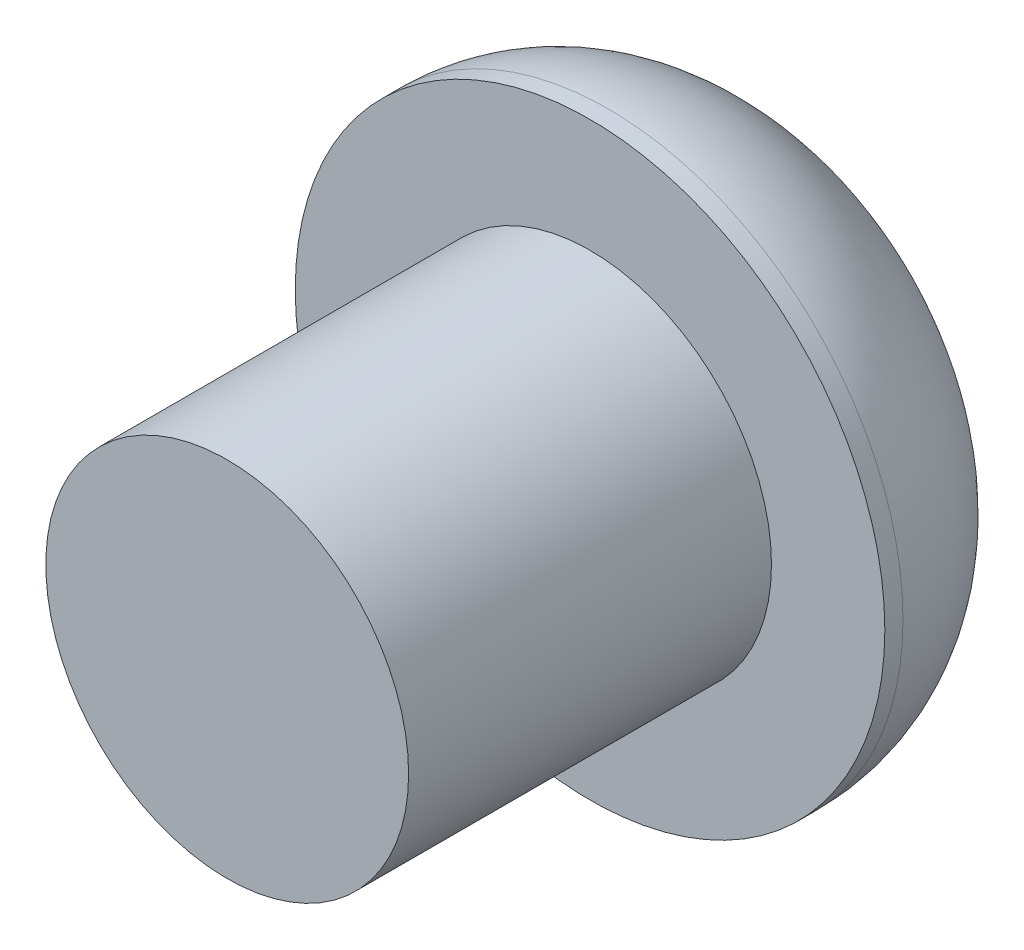
from build123d import *

# Parameters (mm, degrees)
SKETCH_1_R          = 2
EXTRUDE_1_DEPTH     = 4
SKETCH_2_R          = 3.25
EXTRUDE_2_DEPTH     = 2.2
FILLET_1_R          = 2
CUT_EXTRUDE_1_DEPTH = 0.5


with BuildPart() as part:
    # 草图1 → 凸台-拉伸1 (new body)
    with BuildSketch(Plane.XY):
        Circle(SKETCH_1_R)
    extrude(amount=EXTRUDE_1_DEPTH)

    # 草图2 → 凸台-拉伸2 (add)
    with BuildSketch(Plane(origin=(0, 0, 0), x_dir=(-1, 0, 0), z_dir=(0, 0, -1))):
        Circle(SKETCH_2_R)
    extrude(amount=EXTRUDE_2_DEPTH)

    # 圆角1
    fillet_1_edges = [part.edges().sort_by_distance(p)[0] for p in [
        (3.25, 0, -2.2),
    ]]
    fillet(fillet_1_edges, radius=FILLET_1_R)

    # 草图3 → 切除-拉伸1 (cut)
    with BuildSketch(Plane(origin=(0, 0, -2.2), x_dir=(-1, 0, 0), z_dir=(0, 0, -1))):
        Polygon((3.239974874, 0.25), (3.239974874, -0.25), (0.25, -0.25), (0.25, -3.239974874), (-0.25, -3.239974874), (-0.25, -0.25), (-3.239974874, -0.25), (-3.239974874, 0.25), (-0.25, 0.25), (-0.25, 3.239974874), (0.25, 3.239974874), (0.25, 0.25), align=None)
    extrude(amount=-CUT_EXTRUDE_1_DEPTH, mode=Mode.SUBTRACT)


solid = part.part
